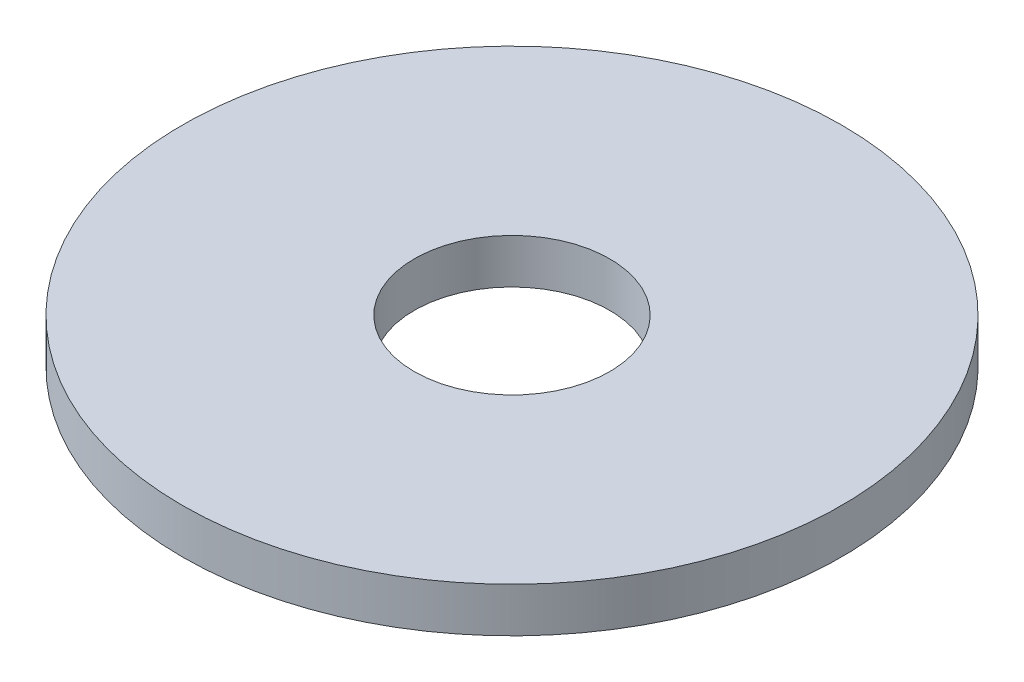
from build123d import *

# Parameters (mm, degrees)
CROQUIS1_R              = 5.9
CROQUIS1_R_2            = 1.75
SALIENTE_EXTRUIR1_DEPTH = 0.8


with BuildPart() as part:
    # Croquis1 → Saliente-Extruir1 (new body)
    with BuildSketch(Plane(origin=(0, 0, 0), x_dir=(1, 0, 0), z_dir=(0, 1, 0))):
        with Locations(Location((0, 0, 0), (0, 0, 270))):
            Circle(CROQUIS1_R)
        with Locations(Location((0, 0, 0), (0, 0, 270))):
            Circle(CROQUIS1_R_2, mode=Mode.SUBTRACT)
    extrude(amount=SALIENTE_EXTRUIR1_DEPTH)


solid = part.part
